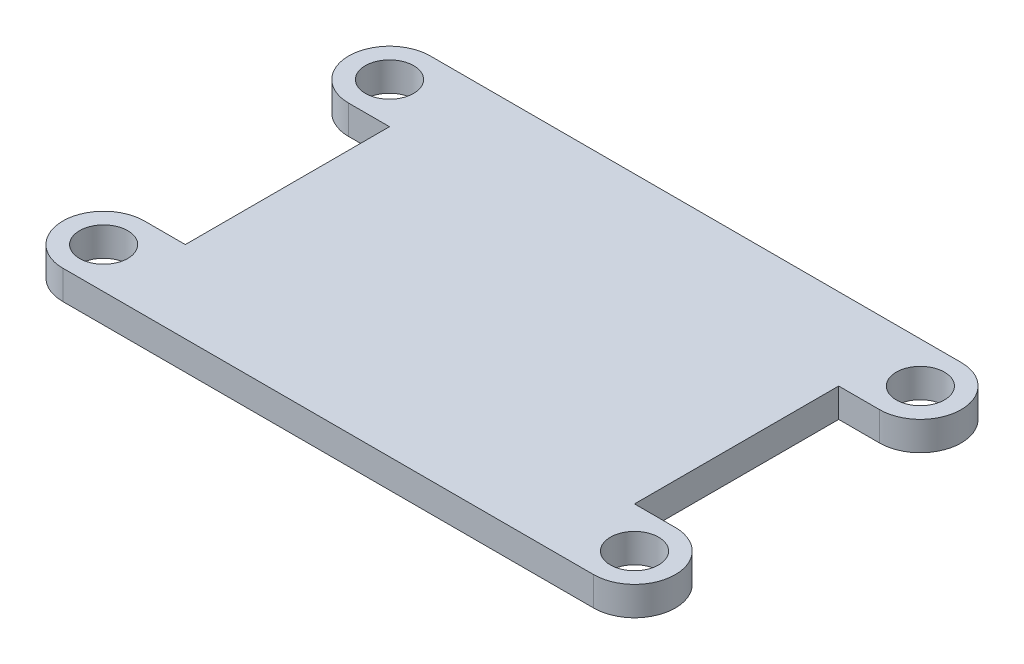
from build123d import *

# Parameters (mm, degrees)
CROQUIS1_R              = 1.5
SALIENTE_EXTRUIR1_DEPTH = 1.8


with BuildPart() as part:
    # Croquis1 → Saliente-Extruir1 (new body)
    with BuildSketch(Plane(origin=(0, 0, 0), x_dir=(1, 0, 0), z_dir=(0, 1, 0))):
        with BuildLine():
            Line((-13.97, 11.43), (-16.51, 11.43))
            ThreePointArc((-16.51, 11.43), (-19.05, 8.89), (-16.51, 6.35))
            Line((-16.51, 6.35), (-13.97, 6.35))
            Line((-13.97, 6.35), (-13.97, -6.35))
            Line((-13.97, -6.35), (-16.51, -6.35))
            ThreePointArc((-16.51, -6.35), (-19.05, -8.89), (-16.51, -11.43))
            Line((-16.51, -11.43), (-13.97, -11.43))
            Line((-13.97, -11.43), (13.97, -11.43))
            Line((13.97, -11.43), (16.51, -11.43))
            ThreePointArc((16.51, -11.43), (19.05, -8.89), (16.51, -6.35))
            Line((16.51, -6.35), (13.97, -6.35))
            Line((13.97, -6.35), (13.97, 6.35))
            Line((13.97, 6.35), (16.51, 6.35))
            ThreePointArc((16.51, 6.35), (19.05, 8.89), (16.51, 11.43))
            Line((16.51, 11.43), (13.97, 11.43))
            Line((13.97, 11.43), (-13.97, 11.43))
        make_face()
        with Locations(Location((-16.51, 8.89, 0), (0, 0, 270))):
            Circle(CROQUIS1_R, mode=Mode.SUBTRACT)
        with Locations(Location((16.51, 8.89, 0), (0, 0, 90))):
            Circle(CROQUIS1_R, mode=Mode.SUBTRACT)
        with Locations(Location((16.51, -8.89, 0), (0, 0, 270))):
            Circle(CROQUIS1_R, mode=Mode.SUBTRACT)
        with Locations(Location((-16.51, -8.89, 0), (0, 0, 90))):
            Circle(CROQUIS1_R, mode=Mode.SUBTRACT)
    extrude(amount=SALIENTE_EXTRUIR1_DEPTH)


solid = part.part
